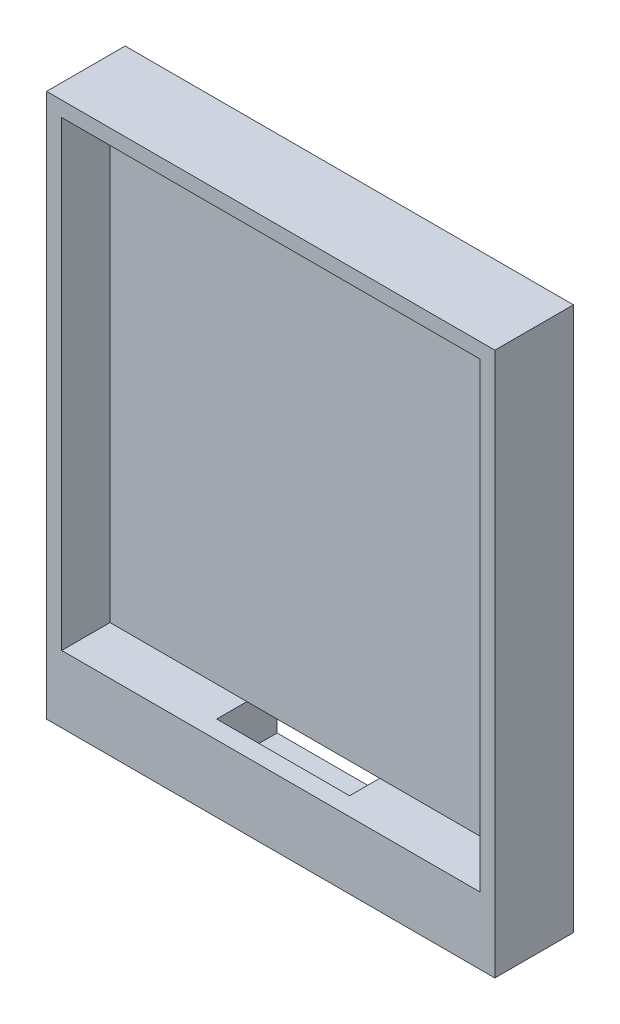
from build123d import *

# Parameters (mm, degrees)
SKETCH2_W           = 74.2
SKETCH2_H           = 90
SKETCH2_W_2         = 69.2
SKETCH2_H_2         = 76.4
BOSS_EXTRUDE1_DEPTH = 8
SKETCH3_W           = 74.2
SKETCH3_H           = 90
BOSS_EXTRUDE2_DEPTH = 5
SKETCH5_W           = 22
SKETCH5_H           = 5
CUT_EXTRUDE1_DEPTH  = 8
SKETCH9_W           = 22
SKETCH9_H           = 7
CUT_EXTRUDE2_DEPTH  = 69.755085919


with BuildPart() as part:
    # Sketch2 → Boss-Extrude1 (new body)
    with BuildSketch(Plane.XY):
        with Locations((0.944957983, -11.708403361)):
            Rectangle(SKETCH2_W, SKETCH2_H)
        with Locations((0.944957983, -7.408403361)):
            Rectangle(SKETCH2_W_2, SKETCH2_H_2, mode=Mode.SUBTRACT)
    extrude(amount=BOSS_EXTRUDE1_DEPTH)

    # Sketch3 → Boss-Extrude2 (add)
    with BuildSketch(Plane(origin=(0, 0, 0), x_dir=(-1, 0, 0), z_dir=(0, 0, -1))):
        with Locations((-0.944957983, -11.708403361)):
            Rectangle(SKETCH3_W, SKETCH3_H)
    extrude(amount=BOSS_EXTRUDE2_DEPTH)

    # Sketch5 → Cut-Extrude1 (cut)
    with BuildSketch(Plane(origin=(0, -45.608403361, 0), x_dir=(1, 0, 0), z_dir=(0, 1, 0))):
        with Locations((0, -2.5)):
            Rectangle(SKETCH5_W, SKETCH5_H)
    extrude(amount=-CUT_EXTRUDE1_DEPTH, mode=Mode.SUBTRACT)

    # Sketch9 → Cut-Extrude2 (cut, through all)
    with BuildSketch(Plane.XY):
        with Locations((0, -49.108403361)):
            Rectangle(SKETCH9_W, SKETCH9_H)
    extrude(amount=-CUT_EXTRUDE2_DEPTH, mode=Mode.SUBTRACT)


solid = part.part
